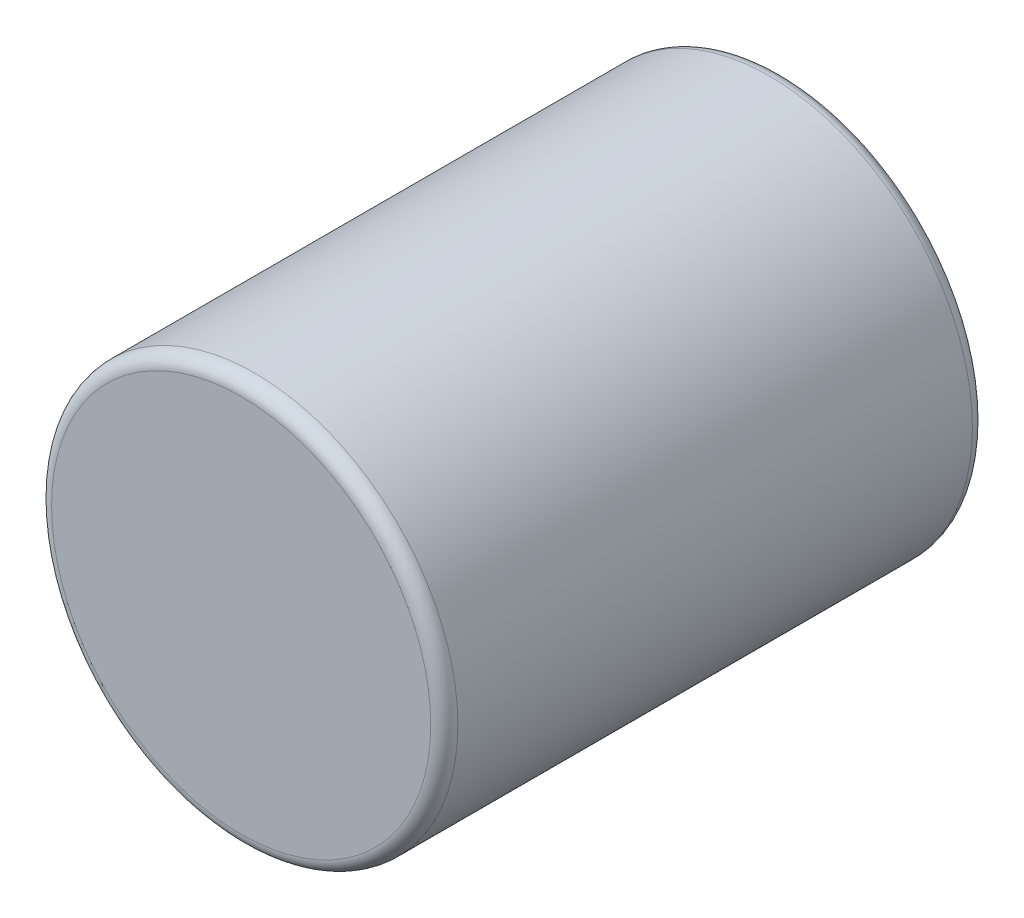
from build123d import *

# Parameters (mm, degrees)
SKETCH_1_R      = 1.5
EXTRUDE_1_DEPTH = 4
FILLET_1_R      = 0.1


with BuildPart() as part:
    # 草图1 → 凸台-拉伸1 (new body)
    with BuildSketch(Plane.XY):
        Circle(SKETCH_1_R)
    extrude(amount=EXTRUDE_1_DEPTH)

    # 圆角1
    fillet_1_edges = [part.edges().sort_by_distance(p)[0] for p in [
        (-1.5, 0, 0),
        (-1.5, 0, 4),
    ]]
    fillet(fillet_1_edges, radius=FILLET_1_R)


solid = part.part
